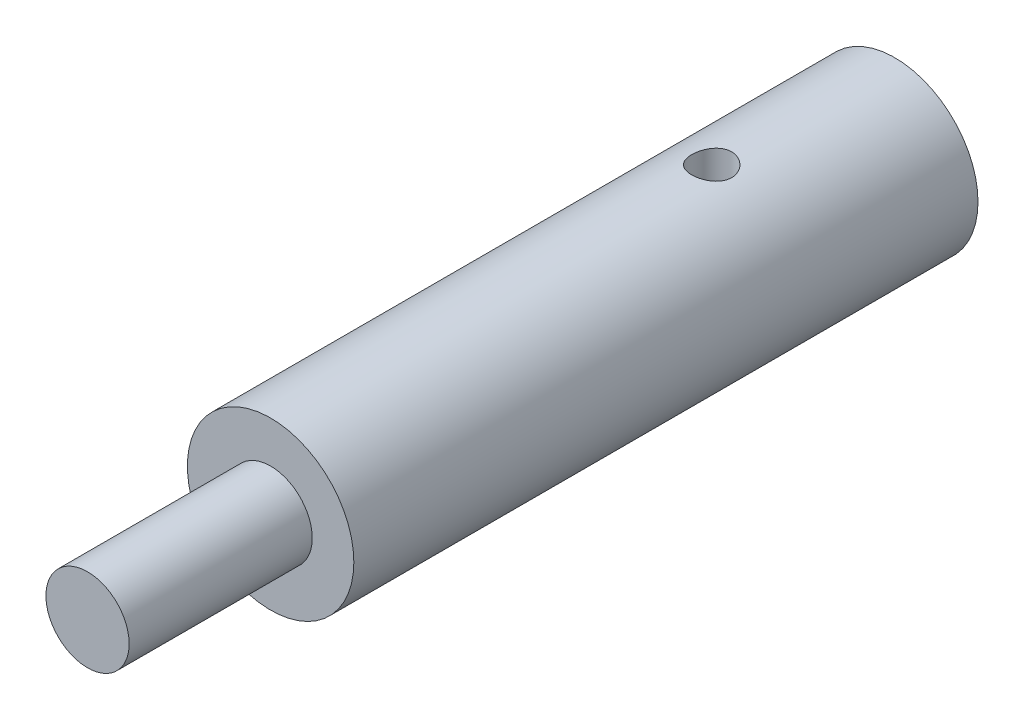
from build123d import *

# Parameters (mm, degrees)
SKETCH2_R          = 2.4
CUT_EXTRUDE1_DEPTH = 10


with BuildPart() as part:
    # Sketch1 → Revolve1 (revolve)
    with BuildSketch(Plane(origin=(0, 0, 0), x_dir=(0, 0, -1), z_dir=(1, 0, 0)), mode=Mode.PRIVATE) as revolve1_sk:
        Polygon((0, 0), (97, 0), (97, 10), (22, 10), (22, 5), (0, 5), align=None)
    revolve(revolve1_sk.sketch.rotate(Axis((0, 0, 0), (0, 0, -1)), 90), axis=Axis((0, 0, 0), (0, 0, -1)))

    # Sketch2 → Cut-Extrude1 (cut, symmetric)
    with BuildSketch(Plane(origin=(0, 0, 0), x_dir=(1, 0, 0), z_dir=(0, 1, 0))):
        with Locations(Location((0, 75, 0), (0, 0, 270))):
            Circle(SKETCH2_R)
    extrude(amount=CUT_EXTRUDE1_DEPTH, both=True, mode=Mode.SUBTRACT)


solid = part.part
